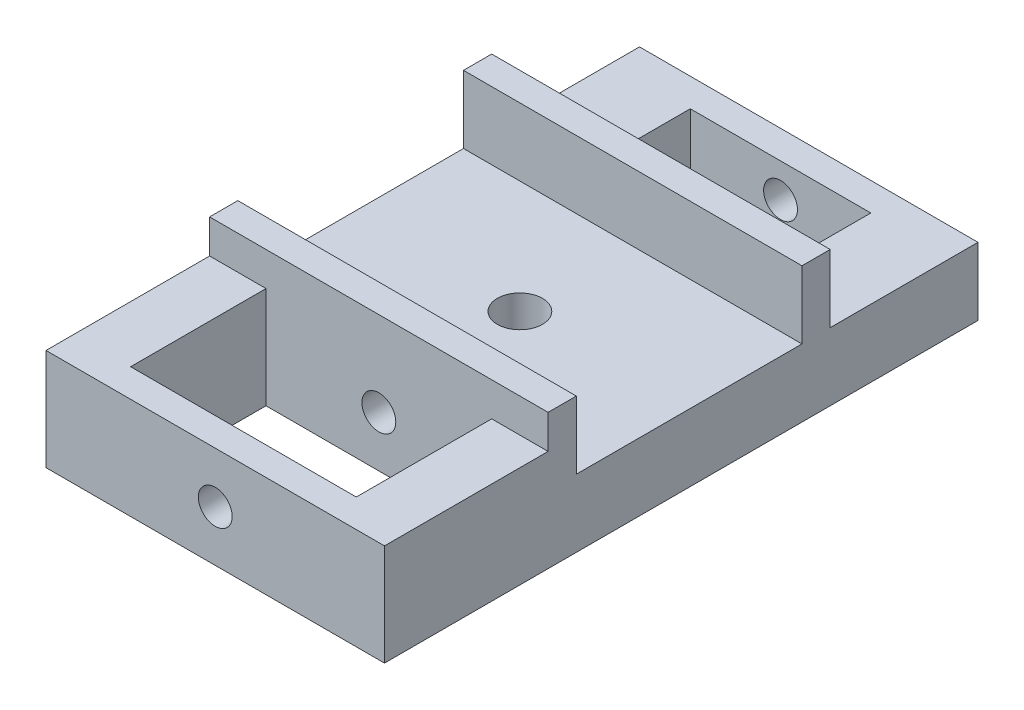
from build123d import *

# Parameters (mm, degrees)
SKETCH1_W           = 30
SKETCH1_H           = 38.1
SKETCH1_W_2         = 16
SKETCH1_H_2         = 10.6
BOSS_EXTRUDE1_DEPTH = 6
SKETCH1_3_W         = 30
SKETCH1_3_H         = 2.5
BOSS_EXTRUDE2_DEPTH = 12
SKETCH3_R           = 1.5
CUT_EXTRUDE2_DEPTH  = 16
SKETCH2_R           = 2
CUT_EXTRUDE1_DEPTH  = 38.976966704
BOSS_EXTRUDE3_DEPTH = 9
SKETCH6_R           = 1.5
CUT_EXTRUDE4_DEPTH  = 16.99


with BuildPart() as part:
    # Sketch1 → Boss-Extrude1 (new body)
    with BuildSketch(Plane(origin=(0, 0, 0), x_dir=(1, 0, 0), z_dir=(0, 1, 0))):
        with Locations((-15, -3.45)):
            Rectangle(SKETCH1_W, SKETCH1_H)
        with Locations((-15, 7.8)):
            Rectangle(SKETCH1_W_2, SKETCH1_H_2, mode=Mode.SUBTRACT)
    extrude(amount=BOSS_EXTRUDE1_DEPTH)

    # Sketch1<3> → Boss-Extrude2 (add)
    with BuildSketch(Plane(origin=(0, 0, 0), x_dir=(1, 0, 0), z_dir=(0, 1, 0))):
        with Locations((-15, -21.25)):
            Rectangle(SKETCH1_3_W, SKETCH1_3_H)
        with Locations((-15, 1.25)):
            Rectangle(SKETCH1_3_W, SKETCH1_3_H)
    extrude(amount=BOSS_EXTRUDE2_DEPTH)

    # Sketch3 → Cut-Extrude2 (cut)
    with BuildSketch(Plane(origin=(0, 0, -15.6), x_dir=(-1, 0, 0), z_dir=(0, 0, -1))):
        with Locations((15, 3)):
            Circle(SKETCH3_R)
    extrude(amount=-CUT_EXTRUDE2_DEPTH, mode=Mode.SUBTRACT)

    # Sketch2 → Cut-Extrude1 (cut, through all)
    with BuildSketch(Plane(origin=(0, 6, 0), x_dir=(1, 0, 0), z_dir=(0, 1, 0))):
        with Locations((-15, -10)):
            Circle(SKETCH2_R)
    extrude(amount=-CUT_EXTRUDE1_DEPTH, mode=Mode.SUBTRACT)

    # Sketch5 → Boss-Extrude3 (add)
    with BuildSketch(Plane.XZ):
        Polygon((-30, 22.5), (-25, 22.5), (-25, 34.5), (-5, 34.5), (-5, 22.5), (0, 22.5), (0, 37), (-30, 37), align=None)
    extrude(amount=-BOSS_EXTRUDE3_DEPTH)

    # Sketch6 → Cut-Extrude4 (cut)
    with BuildSketch(Plane.XY.offset(37)):
        with Locations((-15, 4.5)):
            Circle(SKETCH6_R)
    extrude(amount=-CUT_EXTRUDE4_DEPTH, mode=Mode.SUBTRACT)


solid = part.part
